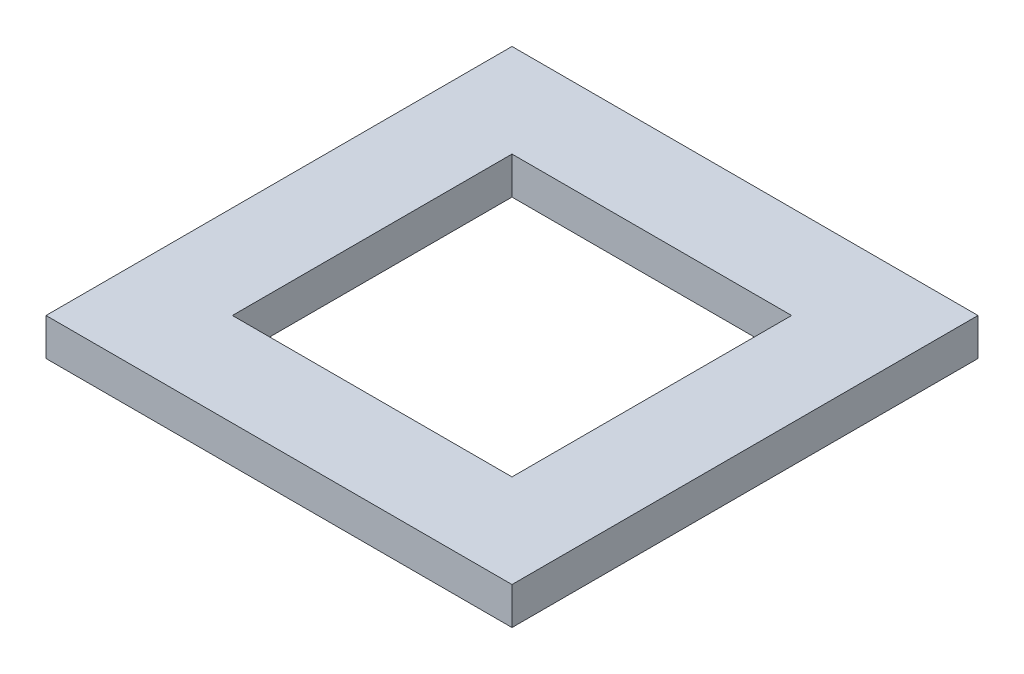
from build123d import *

# Parameters (mm, degrees)
SKETCH1_W           = 25
SKETCH1_H           = 25
SKETCH1_W_2         = 15
SKETCH1_H_2         = 15
BOSS_EXTRUDE1_DEPTH = 2


with BuildPart() as part:
    # Sketch1 → Boss-Extrude1 (new body)
    with BuildSketch(Plane(origin=(0, 0, 0), x_dir=(1, 0, 0), z_dir=(0, 1, 0))):
        Rectangle(SKETCH1_W, SKETCH1_H)
        Rectangle(SKETCH1_W_2, SKETCH1_H_2, mode=Mode.SUBTRACT)
    extrude(amount=BOSS_EXTRUDE1_DEPTH)


solid = part.part
